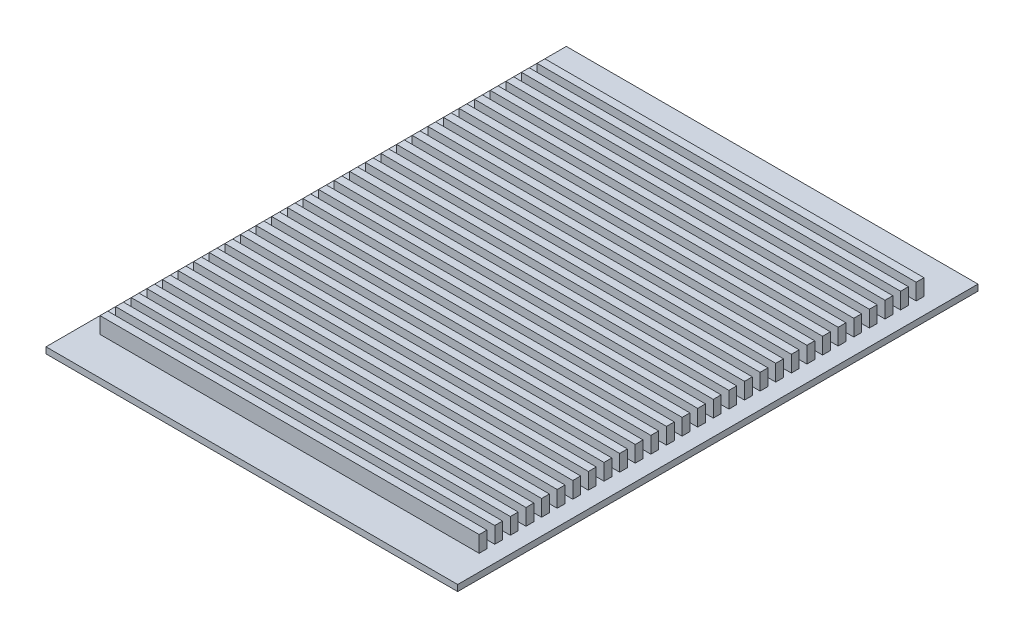
from build123d import *

# Parameters (mm, degrees)
SKETCH1_W           = 160.782
SKETCH1_H           = 203.2
BOSS_EXTRUDE1_DEPTH = 2.413
SKETCH2_W           = 148.082
SKETCH2_H           = 3.048
BOSS_EXTRUDE2_DEPTH = 6.35


with BuildPart() as part:
    # Sketch1 → Boss-Extrude1 (new body)
    with BuildSketch(Plane(origin=(0, 0, 0), x_dir=(1, 0, 0), z_dir=(0, 1, 0))):
        with Locations((80.391, 101.6)):
            Rectangle(SKETCH1_W, SKETCH1_H)
    extrude(amount=BOSS_EXTRUDE1_DEPTH)

    # Sketch2 → Boss-Extrude2 (add)
    with BuildSketch(Plane(origin=(0, 2.413, 0), x_dir=(1, 0, 0), z_dir=(0, 1, 0))):
        with Locations((80.391, 180.848)):
            Rectangle(SKETCH2_W, SKETCH2_H)
        with Locations((80.391, 186.944)):
            Rectangle(SKETCH2_W, SKETCH2_H)
        with Locations((80.391, 174.752)):
            Rectangle(SKETCH2_W, SKETCH2_H)
        with Locations((80.391, 168.656)):
            Rectangle(SKETCH2_W, SKETCH2_H)
        with Locations((80.391, 162.56)):
            Rectangle(SKETCH2_W, SKETCH2_H)
        with Locations((80.391, 156.464)):
            Rectangle(SKETCH2_W, SKETCH2_H)
        with Locations((80.391, 150.368)):
            Rectangle(SKETCH2_W, SKETCH2_H)
        with Locations((80.391, 144.272)):
            Rectangle(SKETCH2_W, SKETCH2_H)
        with Locations((80.391, 138.176)):
            Rectangle(SKETCH2_W, SKETCH2_H)
        with Locations((80.391, 132.08)):
            Rectangle(SKETCH2_W, SKETCH2_H)
        with Locations((80.391, 125.984)):
            Rectangle(SKETCH2_W, SKETCH2_H)
        with Locations((80.391, 119.888)):
            Rectangle(SKETCH2_W, SKETCH2_H)
        with Locations((80.391, 113.792)):
            Rectangle(SKETCH2_W, SKETCH2_H)
        with Locations((80.391, 107.696)):
            Rectangle(SKETCH2_W, SKETCH2_H)
        with Locations((80.391, 101.6)):
            Rectangle(SKETCH2_W, SKETCH2_H)
        with Locations((80.391, 95.504)):
            Rectangle(SKETCH2_W, SKETCH2_H)
        with Locations((80.391, 89.408)):
            Rectangle(SKETCH2_W, SKETCH2_H)
        with Locations((80.391, 83.312)):
            Rectangle(SKETCH2_W, SKETCH2_H)
        with Locations((80.391, 77.216)):
            Rectangle(SKETCH2_W, SKETCH2_H)
        with Locations((80.391, 71.12)):
            Rectangle(SKETCH2_W, SKETCH2_H)
        with Locations((80.391, 65.024)):
            Rectangle(SKETCH2_W, SKETCH2_H)
        with Locations((80.391, 58.928)):
            Rectangle(SKETCH2_W, SKETCH2_H)
        with Locations((80.391, 52.832)):
            Rectangle(SKETCH2_W, SKETCH2_H)
        with Locations((80.391, 46.736)):
            Rectangle(SKETCH2_W, SKETCH2_H)
        with Locations((80.391, 40.64)):
            Rectangle(SKETCH2_W, SKETCH2_H)
        with Locations((80.391, 34.544)):
            Rectangle(SKETCH2_W, SKETCH2_H)
        with Locations((80.391, 28.448)):
            Rectangle(SKETCH2_W, SKETCH2_H)
        with Locations((80.391, 22.352)):
            Rectangle(SKETCH2_W, SKETCH2_H)
        with Locations((80.391, 16.256)):
            Rectangle(SKETCH2_W, SKETCH2_H)
    extrude(amount=BOSS_EXTRUDE2_DEPTH)


solid = part.part
